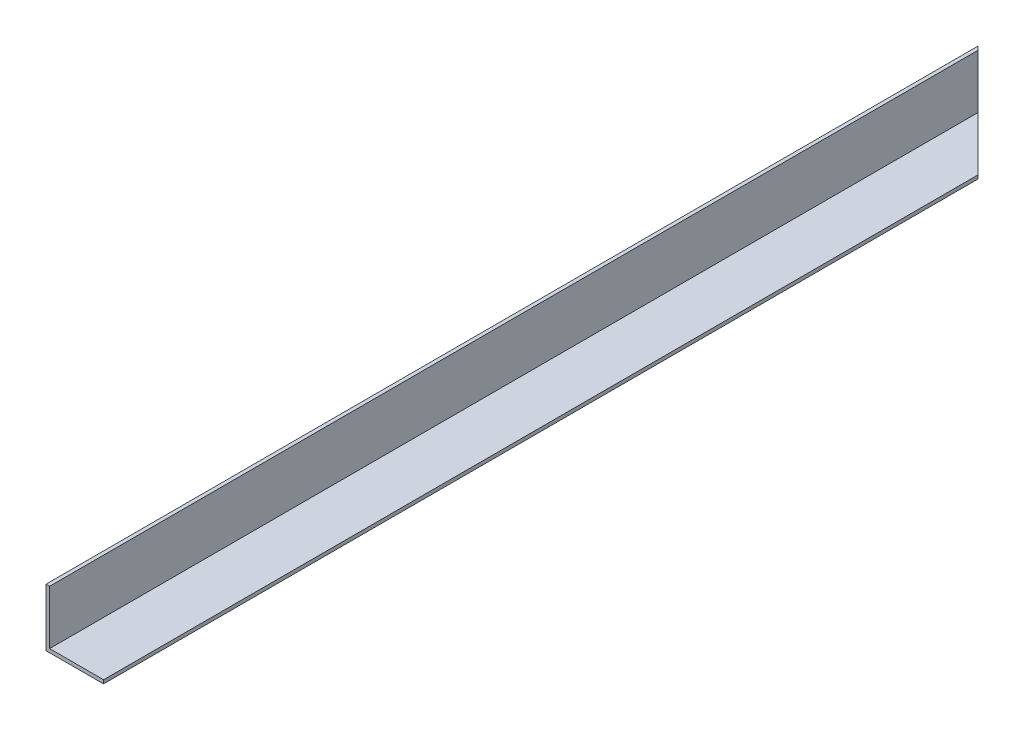
from build123d import *

# Parameters (mm, degrees)
EXTRUDE_THIN1_DEPTH = 259
CUT_EXTRUDE1_DEPTH  = 260.926912804


with BuildPart() as part:
    # Sketch1 → Extrude-Thin1 (new body)
    with BuildSketch(Plane.XY):
        Polygon((15, 0), (0, 0), (0, 15), (-1, 15), (-1, -1), (15, -1), align=None)
    extrude(amount=EXTRUDE_THIN1_DEPTH)

    # Sketch2 → Cut-Extrude1 (cut, through all)
    with BuildSketch(Plane(origin=(0, -1, 0), x_dir=(-1, 0, 0), z_dir=(0, -1, 0))):
        Polygon((-15, 0), (1, 0), (-15, -16), align=None)
    extrude(amount=-CUT_EXTRUDE1_DEPTH, mode=Mode.SUBTRACT)


solid = part.part
